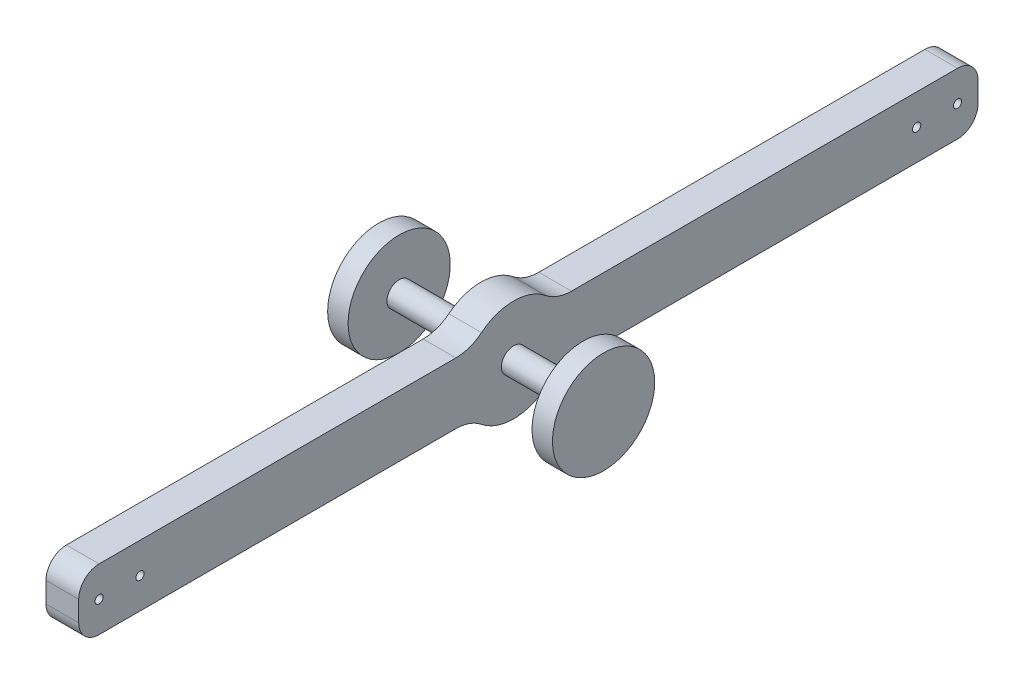
from build123d import *

# Parameters (mm, degrees)
SKETCH_1_W           = 120
SKETCH_1_H           = 15
EXTRUDE_1_DEPTH      = 8
FILLET_1_R           = 5
SKETCH_6_R           = 12.5
EXTRUDE_2_DEPTH      = 8
SKETCH_9_W           = 8
SKETCH_9_H           = 15
EXTRUDE_3_DEPTH      = 100
FILLET_2_R           = 10
FILLET_4_R           = 5
SKETCH_11_R          = 1
CUT_EXTRUDE_8_DEPTH  = 10
EXTRUDE_5_DEPTH      = 20
EXTRUDE_5_DEPTH_BACK = 25
SKETCH_15_R          = 3
SKETCH_16_R          = 12.5
EXTRUDE_6_DEPTH      = 5
EXTRUDE_START        = 5
SKETCH_17_R          = 12.5
EXTRUDE_7_DEPTH      = 5


with BuildPart() as part:
    # 草图1 → 凸台-拉伸1 (new body)
    with BuildSketch(Plane(origin=(0, 0, 0), x_dir=(0, 0, -1), z_dir=(1, 0, 0))):
        with Locations((60, 7.5)):
            Rectangle(SKETCH_1_W, SKETCH_1_H)
    extrude(amount=EXTRUDE_1_DEPTH)

    # 圆角1
    fillet_1_edges = [part.edges().sort_by_distance(p)[0] for p in [
        (4, 15, 0),
        (4, 15, -120),
        (4, 0, -120),
        (4, 0, 0),
    ]]
    fillet(fillet_1_edges, radius=FILLET_1_R)

    # 草图6 → 凸台-拉伸2 (add)
    with BuildSketch(Plane(origin=(8, 0, 0), x_dir=(0, 0, -1), z_dir=(1, 0, 0))):
        with Locations((6.4, 7.5)):
            Circle(SKETCH_6_R)
    extrude(amount=-EXTRUDE_2_DEPTH)

    # 草图9 → 凸台-拉伸3 (add)
    with BuildSketch(Plane.XY):
        with Locations((4, 7.5)):
            Rectangle(SKETCH_9_W, SKETCH_9_H)
    extrude(amount=EXTRUDE_3_DEPTH)

    # 圆角2
    fillet_2_edges = [part.edges().sort_by_distance(p)[0] for p in [
        (4, 0, -16.4),
        (4, 15, -16.4),
        (4, 15, 3.6),
        (4, 0, 3.6),
    ]]
    fillet(fillet_2_edges, radius=FILLET_2_R)

    # 圆角4
    fillet_4_edges = [part.edges().sort_by_distance(p)[0] for p in [
        (4, 0, 100),
        (4, 15, 100),
    ]]
    fillet(fillet_4_edges, radius=FILLET_4_R)

    # 草图11 → 切除-拉伸8 (cut)
    with BuildSketch(Plane.ZY):
        with Locations((-115, 7.5)):
            Circle(SKETCH_11_R)
        with Locations((-105, 7.5)):
            Circle(SKETCH_11_R)
        with Locations((85, 7.5)):
            Circle(SKETCH_11_R)
        with Locations((95, 7.5)):
            Circle(SKETCH_11_R)
    extrude(amount=-CUT_EXTRUDE_8_DEPTH, mode=Mode.SUBTRACT)

    # 草图15 → 凸台-拉伸5 (add, two sides: drawn at the far end of the back side and taken through both)
    with BuildSketch(Plane.ZY.offset(-EXTRUDE_5_DEPTH_BACK)):
        with Locations((-6.4, 7.5)):
            Circle(SKETCH_15_R)
    extrude(amount=EXTRUDE_5_DEPTH + EXTRUDE_5_DEPTH_BACK)

    # 草图16 → 凸台-拉伸6 (add)
    with BuildSketch(Plane.ZY.offset(20)):
        with Locations((-6.4, 7.5)):
            Circle(SKETCH_16_R)
    extrude(amount=EXTRUDE_6_DEPTH)

    # 草图17 → 凸台-拉伸7 (add)
    with BuildSketch(Plane(origin=(25, 0, 0), x_dir=(0, 0, -1), z_dir=(1, 0, 0)).offset(EXTRUDE_START)):
        with Locations(Location((6.4, 7.5, 0), (0, 0, 180))):
            Circle(SKETCH_17_R)
    extrude(amount=-EXTRUDE_7_DEPTH)


solid = part.part
